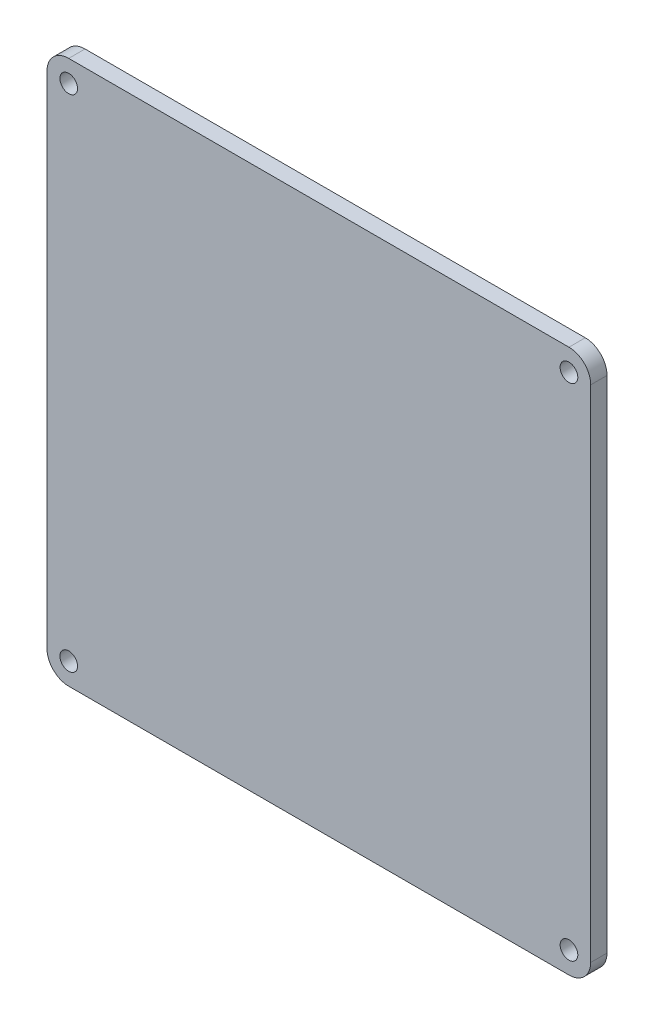
from build123d import *

# Parameters (mm, degrees)
IZIM1_W                     = 100
IZIM1_H                     = 100
Y_KSEKLIK_EKSTR_ZYON1_DEPTH = 3
RADYUS1_R                   = 4
IZIM12_R                    = 1.625
KES_EKSTR_ZYON7_DEPTH       = 83.228005541


with BuildPart() as part:
    # Çizim1 → Yükseklik-Ekstrüzyon1 (new body)
    with BuildSketch(Plane.XY):
        with Locations((2.279635258, 13.397828294)):
            Rectangle(IZIM1_W, IZIM1_H)
    extrude(amount=Y_KSEKLIK_EKSTR_ZYON1_DEPTH)

    # Radyus1
    radyus1_edges = [part.edges().sort_by_distance(p)[0] for p in [
        (-47.720364742, 63.397828294, 1.5),
        (52.279635258, 63.397828294, 1.5),
        (52.279635258, -36.602171706, 1.5),
        (-47.720364742, -36.602171706, 1.5),
    ]]
    fillet(radyus1_edges, radius=RADYUS1_R)

    # Çizim12 → Kes-Ekstrüzyon7 (cut, through all)
    with BuildSketch(Plane(origin=(0, 0, 0), x_dir=(-1, 0, 0), z_dir=(0, 0, -1))):
        with Locations((-48.279635258, 59.397828294)):
            Circle(IZIM12_R)
        with Locations((43.720364742, 59.397828294)):
            Circle(IZIM12_R)
        with Locations((43.720364742, -32.602171706)):
            Circle(IZIM12_R)
        with Locations((-48.279635258, -32.602171706)):
            Circle(IZIM12_R)
    extrude(amount=-KES_EKSTR_ZYON7_DEPTH, mode=Mode.SUBTRACT)


solid = part.part
